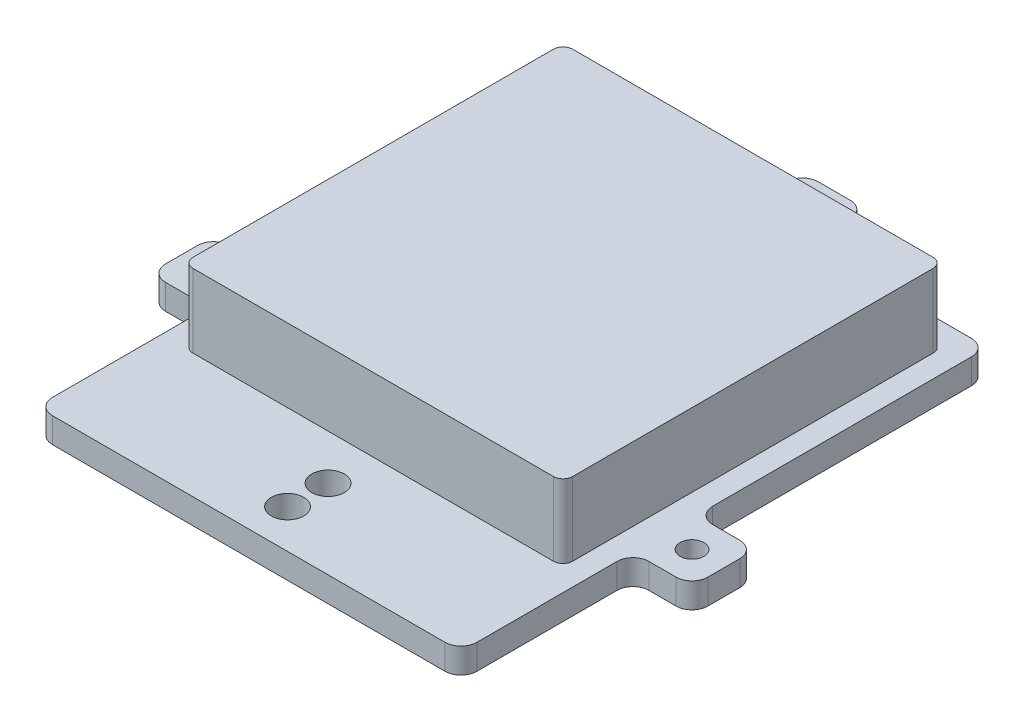
from build123d import *

# Parameters (mm, degrees)
SKETCH1_R           = 0.375
BOSS_EXTRUDE1_DEPTH = 0.7874
BOSS_EXTRUDE2_DEPTH = 2.3
FILLET1_R           = 0.5
SKETCH3_R           = 0.508
CUT_EXTRUDE1_DEPTH  = 0.7874


with BuildPart() as part:
    # Sketch1 → Boss-Extrude1 (new body)
    with BuildSketch(Plane(origin=(0, 0, 0), x_dir=(1, 0, 0), z_dir=(0, 1, 0))):
        Polygon((-1, 8.25), (-1, 10.1), (1, 10.1), (1, 8.25), (6.65, 8.25), (6.65, -0.858517924), (8.5, -0.858517924), (8.5, -2.858517924), (6.65, -2.858517924), (6.65, -8.25), (-6.65, -8.25), (-6.65, -2.858517924), (-8.5, -2.858517924), (-8.5, -0.858517924), (-6.65, -0.858517924), (-6.65, 8.25), align=None)
        with Locations(Location((-7.5, -1.858517924, 0), (0, 0, 270))):
            Circle(SKETCH1_R, mode=Mode.SUBTRACT)
        with Locations(Location((7.5, -1.858517924, 0), (0, 0, 270))):
            Circle(SKETCH1_R, mode=Mode.SUBTRACT)
        with Locations(Location((0, 9.141482076, 0), (0, 0, 270))):
            Circle(SKETCH1_R, mode=Mode.SUBTRACT)
    extrude(amount=BOSS_EXTRUDE1_DEPTH)

    # Sketch2 → Boss-Extrude2 (add)
    with BuildSketch(Plane(origin=(0, 0.7874, 0), x_dir=(1, 0, 0), z_dir=(0, 1, 0))):
        with BuildLine():
            Line((5.65, 7.55), (-5.65, 7.55))
            ThreePointArc((-5.65, 7.55), (-5.862132034, 7.462132034), (-5.95, 7.25))
            Line((-5.95, 7.25), (-5.95, -4.05))
            ThreePointArc((-5.95, -4.05), (-5.862132034, -4.262132034), (-5.65, -4.35))
            Line((-5.65, -4.35), (5.65, -4.35))
            ThreePointArc((5.65, -4.35), (5.862132034, -4.262132034), (5.95, -4.05))
            Line((5.95, -4.05), (5.95, 7.25))
            ThreePointArc((5.95, 7.25), (5.862132034, 7.462132034), (5.65, 7.55))
        make_face()
    extrude(amount=BOSS_EXTRUDE2_DEPTH)

    # Fillet1
    fillet1_edges = [part.edges().sort_by_distance(p)[0] for p in [
        (-6.65, 0.3937, 2.858517924),
        (-8.5, 0.3937, 2.858517924),
        (-8.5, 0.3937, 0.858517924),
        (-6.65, 0.3937, 0.858517924),
        (-6.65, 0.3937, -8.25),
        (-1, 0.3937, -8.25),
        (-1, 0.3937, -10.1),
        (1, 0.3937, -10.1),
        (1, 0.3937, -8.25),
        (6.65, 0.3937, -8.25),
        (6.65, 0.3937, 0.858517924),
        (8.5, 0.3937, 0.858517924),
        (8.5, 0.3937, 2.858517924),
        (6.65, 0.3937, 2.858517924),
        (6.65, 0.3937, 8.25),
        (-6.65, 0.3937, 8.25),
    ]]
    fillet(fillet1_edges, radius=FILLET1_R)

    # Sketch3 → Cut-Extrude1 (cut)
    with BuildSketch(Plane(origin=(0, 0.7874, 0), x_dir=(1, 0, 0), z_dir=(0, 1, 0))):
        with Locations(Location((0, -5.76619869, 0), (0, 0, 270))):
            Circle(SKETCH3_R)
        with Locations(Location((0, -7.03619869, 0), (0, 0, 270))):
            Circle(SKETCH3_R)
    extrude(amount=-CUT_EXTRUDE1_DEPTH, mode=Mode.SUBTRACT)


solid = part.part
